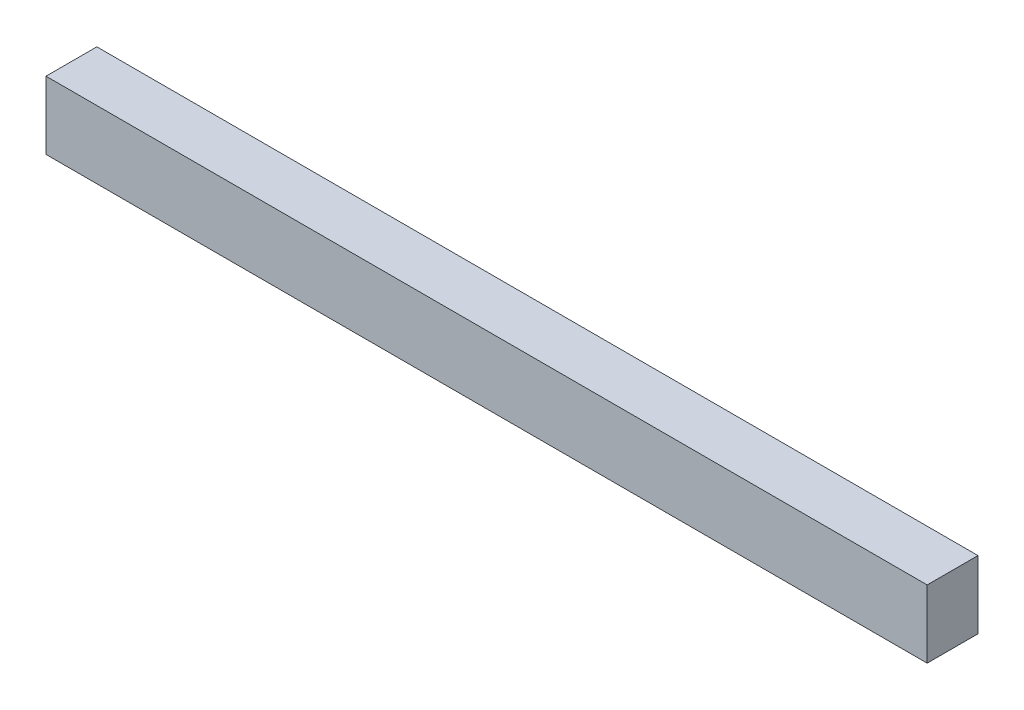
from build123d import *

# Parameters (mm, degrees)
ESQUISSE1_W        = 520
ESQUISSE1_H        = 40
BOSS_EXTRU_1_DEPTH = 30


with BuildPart() as part:
    # Esquisse1 → Boss.-Extru.1 (new body)
    with BuildSketch(Plane.XY):
        with Locations((260, 20)):
            Rectangle(ESQUISSE1_W, ESQUISSE1_H)
    extrude(amount=BOSS_EXTRU_1_DEPTH)


solid = part.part
